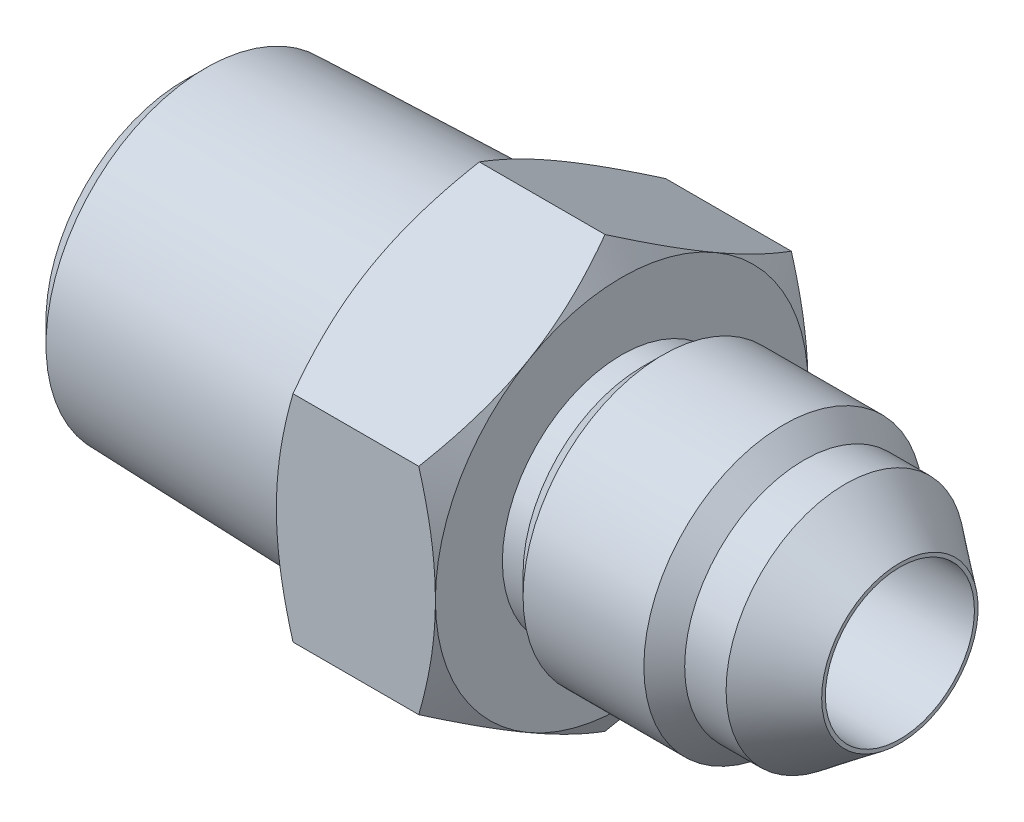
from build123d import *

# Parameters (mm, degrees)
SKETCH6_W           = 36.576
SKETCH6_H           = 7.14375
EXTRUDE1_DEPTH      = 8.128
SKETCH7_W           = 36.576
SKETCH7_H           = 3.81
SKETCH17_R          = 7.14375
CUT_EXTRUDE1_DEPTH  = 14.224
SKETCH19_R          = 8.5725
BOSS_EXTRUDE1_DEPTH = 14.224
BOSS_EXTRUDE1_DRAFT = -1.75
CHAMFER1_SIZE       = 1.058333333
CHAMFER1_SIZE2      = 1.092196811
SKETCH22_R          = 8.5725
BOSS_EXTRUDE3_DEPTH = 14.224
BOSS_EXTRUDE3_DRAFT = -15
SKETCH23_R          = 3.81
CUT_EXTRUDE2_DEPTH  = 14.224


with BuildPart() as part:
    # Sketch6 → Revolve3 (revolve)
    with BuildSketch(Plane.XY, mode=Mode.PRIVATE) as revolve3_sk:
        with Locations((0, 3.571875)):
            Rectangle(SKETCH6_W, SKETCH6_H)
    revolve(revolve3_sk.sketch.rotate(Axis((-18.288, 0, 0), (1, 0, 0)), 90), axis=Axis((-18.288, 0, 0), (1, 0, 0)))

    # Sketch12 → Extrude1 (add)
    with BuildSketch(Plane(origin=(-4.064, 0, 0), x_dir=(0, 0, -1), z_dir=(1, 0, 0))):
        Polygon((0, 10.998522628), (-9.525, 5.499261314), (-9.525, -5.499261314), (0, -10.998522628), (9.525, -5.499261314), (9.525, 5.499261314), align=None)
    extrude(amount=EXTRUDE1_DEPTH)

    # Sketch10 → Cut-Revolve6 (revolve, cut)
    with BuildSketch(Plane.XY, mode=Mode.PRIVATE) as cut_revolve6_sk:
        Polygon((6.165876886, 7.14375), (4.064, 7.14375), (4.064, 6.100206448), (5.122333333, 6.100206448), align=None)
        Polygon((18.288, 7.14375), (12.341385213, 7.14375), (13.384928765, 6.100206448), (15.501595432, 6.100206448), (18.288, 4.0005), align=None)
    revolve(cut_revolve6_sk.sketch.rotate(Axis((-18.288, 0, 0), (1, 0, 0)), 90), axis=Axis((-18.288, 0, 0), (1, 0, 0)), mode=Mode.SUBTRACT)

    # Sketch7 → Cut-Revolve5 (revolve, cut)
    with BuildSketch(Plane.XY):
        with Locations((0, 1.905)):
            Rectangle(SKETCH7_W, SKETCH7_H)
    revolve(axis=Axis((18.288, 0, 0), (-1, 0, 0)), mode=Mode.SUBTRACT)

    # Sketch13 → Cut-Revolve7 (revolve, cut)
    with BuildSketch(Plane.XY):
        Polygon((-4.064, 10.998522628), (-4.064, 9.525), (-3.213261314, 10.998522628), align=None)
        Polygon((3.213261314, 10.998522628), (4.064, 9.525), (4.064, 10.998522628), align=None)
    revolve(axis=Axis((-18.288, 0, 0), (1, 0, 0)), mode=Mode.SUBTRACT)

    # Sketch17 → Cut-Extrude1 (cut)
    with BuildSketch(Plane.ZY.offset(18.288)):
        Circle(SKETCH17_R)
    extrude(amount=-CUT_EXTRUDE1_DEPTH, mode=Mode.SUBTRACT)


with BuildPart() as body_2:
    # Sketch19 → Boss-Extrude1 (with draft: the straight prism first)
    with BuildSketch(Plane(origin=(-4.064, 0, 0), x_dir=(0, 0, -1), z_dir=(1, 0, 0))):
        Circle(SKETCH19_R)
    extrude(amount=-BOSS_EXTRUDE1_DEPTH)
    # Boss-Extrude1: the draft: its side faces are tilted about the plane it starts from
    boss_extrude1_sides = [body_2.faces().sort_by_distance(p)[0] for p in [
        (-11.176, 0, 8.5725),
    ]]
    draft(boss_extrude1_sides, Plane(origin=(-4.064, 0, 0), x_dir=(0, 0, -1), z_dir=(1, 0, 0)), BOSS_EXTRUDE1_DRAFT)

    # Chamfer1
    chamfer1_edges = [body_2.edges().sort_by_distance(p)[0] for p in [
        (-18.288, 0, 8.137917495),
    ]]
    chamfer1_side = [body_2.faces().sort_by_distance(p)[0] for p in [
        (-18.288, 0, 0),
    ]]
    chamfer(chamfer1_edges, length=CHAMFER1_SIZE, length2=CHAMFER1_SIZE2, reference=chamfer1_side[0])


with BuildPart() as boss_extrude3_tool:
    # Sketch22 → Boss-Extrude3 (with draft: the straight prism first)
    with BuildSketch(Plane(origin=(-4.064, 0, 0), x_dir=(0, 0, -1), z_dir=(1, 0, 0))):
        Circle(SKETCH22_R)
    extrude(amount=-BOSS_EXTRUDE3_DEPTH)
    # Boss-Extrude3: the draft: its side faces are tilted about the plane it starts from
    boss_extrude3_sides = [boss_extrude3_tool.faces().sort_by_distance(p)[0] for p in [
        (-11.176, 0, 8.5725),
    ]]
    draft(boss_extrude3_sides, Plane(origin=(-4.064, 0, 0), x_dir=(0, 0, -1), z_dir=(1, 0, 0)), BOSS_EXTRUDE3_DRAFT)


with BuildPart() as body_2_1:
    add(body_2.part)

    # Boss-Extrude3: add boss_extrude3_tool
    add(boss_extrude3_tool.part)

    # Combine1: union part
    add(part.part)

    # Sketch23 → Cut-Extrude2 (cut)
    with BuildSketch(Plane.ZY.offset(18.288)):
        with Locations(Location((0, 0, 0), (0, 0, 90))):
            Circle(SKETCH23_R)
    extrude(amount=-CUT_EXTRUDE2_DEPTH, mode=Mode.SUBTRACT)


solid = body_2_1.part
